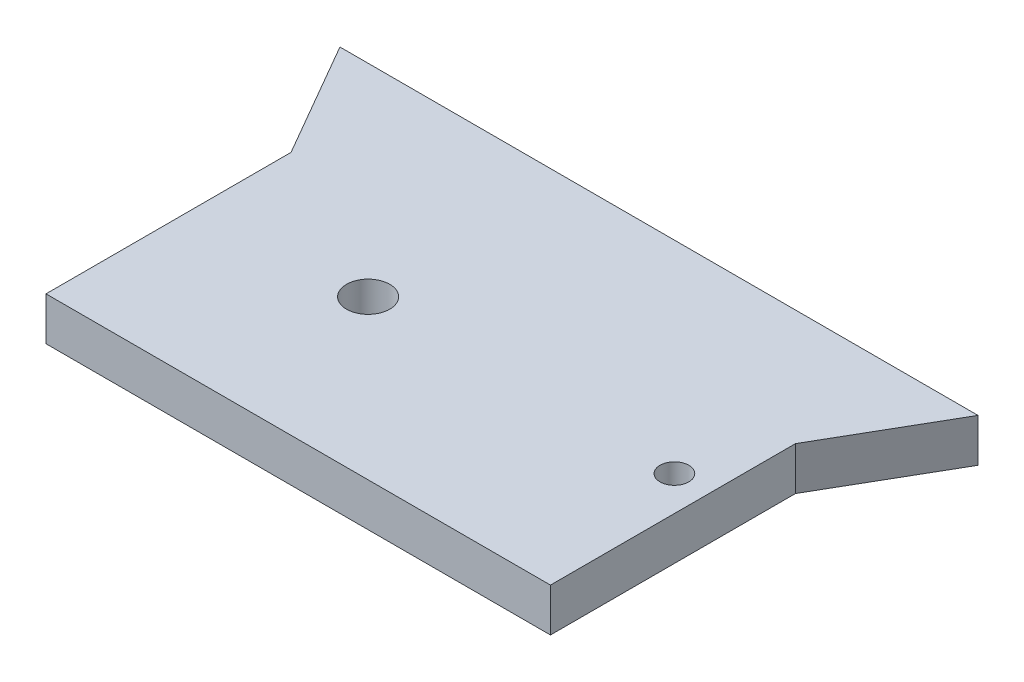
from build123d import *

# Parameters (mm, degrees)
SKETCH_1_R      = 1
SKETCH_1_R_2    = 1.5
EXTRUDE_1_DEPTH = 3


with BuildPart() as part:
    # 草图1 → 凸台-拉伸1 (new body)
    with BuildSketch(Plane(origin=(0, 0, 0), x_dir=(1, 0, 0), z_dir=(0, 1, 0))):
        Polygon((-28.838252362, 9.21144671), (-28.838252362, -7.78855329), (6.161747638, -7.78855329), (6.161747638, 9.21144671), (10.797061323, 17.240045522), (-33.473566048, 17.240045522), align=None)
        with Locations(Location((3.761747638, 3.21144671, 0), (0, 0, 270))):
            Circle(SKETCH_1_R, mode=Mode.SUBTRACT)
        with Locations(Location((-17.488252362, 3.21144671, 0), (0, 0, 270))):
            Circle(SKETCH_1_R_2, mode=Mode.SUBTRACT)
    extrude(amount=EXTRUDE_1_DEPTH)


solid = part.part
